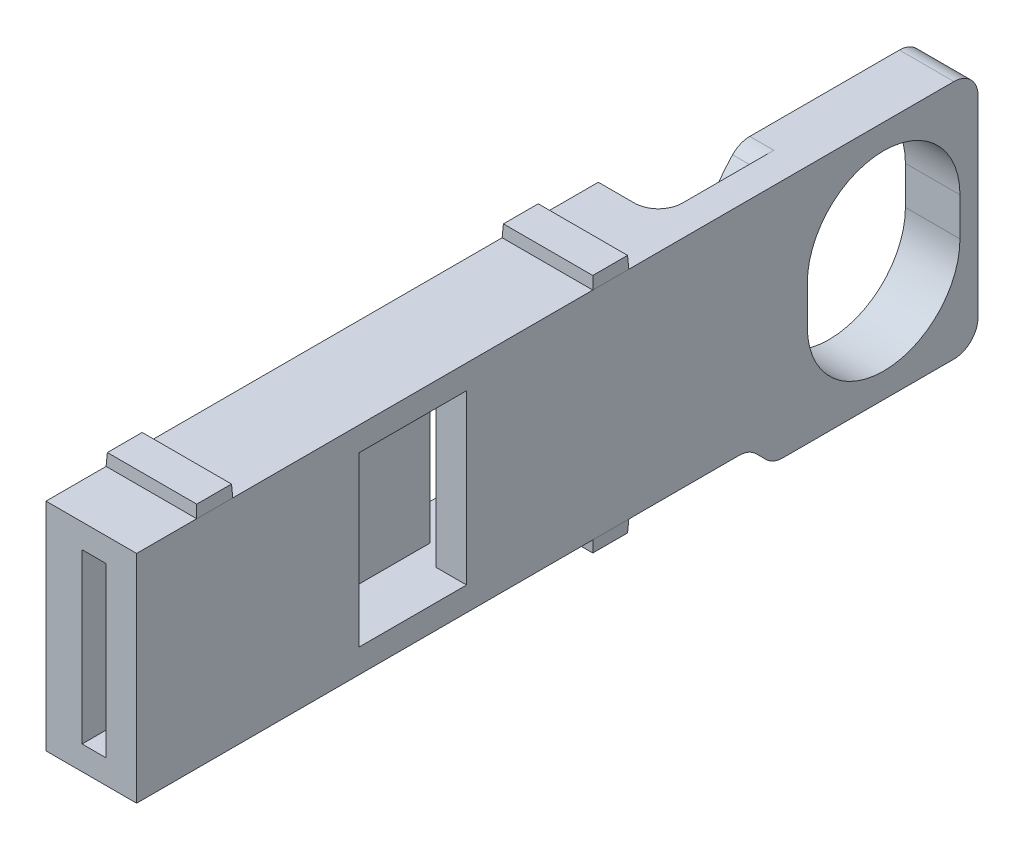
from build123d import *

# Parameters (mm, degrees)
EXTRUDE1_DEPTH           = 2.54
EXTRUDE2_START           = 2
EXTRUDE2_DEPTH           = 2
SKETCH4_W                = 45.95
SKETCH4_H                = 18
SKETCH4_W_2              = 41.95
SKETCH4_H_2              = 14
EXTRUDE3_DEPTH           = 5
SKETCH5_W                = 11.95
SKETCH5_H                = 14
EXTRUDE4_DEPTH           = 5
SKETCH6_W                = 2
SKETCH6_H                = 14
CUT_EXTRUDE1_DEPTH       = 43.95
CUT_EXTRUDE2_REACH       = 65.399
SKETCH7_W                = 8.95
SKETCH7_H                = 14
FILLET1_R                = 2
SKETCH8_W                = 7.54
SKETCH8_H                = 3
EXTRUDE5_DEPTH           = 1
EXTRUDE5_DRAFT           = 3
EXTRUDE5_PROFILE_2_DEPTH = 1
EXTRUDE5_PROFILE_2_DRAFT = 3
SKETCH9_W                = 7.54
SKETCH9_H                = 3
EXTRUDE6_DEPTH           = 1
EXTRUDE6_TAPER           = 3


with BuildPart() as part:
    # Sketch1 → Extrude1 (new body)
    with BuildSketch(Plane(origin=(0, 0, 0), x_dir=(0, 0, -1), z_dir=(1, 0, 0))):
        Polygon((-62.15, 10), (7.85, 10), (7.85, -10), (-9.2, -10), (-11.2, -8), (-62.15, -8), align=None)
        with BuildLine():
            Line((-6.35, 1.5875), (-6.35, -1.5875))
            ThreePointArc((-6.35, -1.5875), (0, -7.9375), (6.35, -1.5875))
            Line((6.35, -1.5875), (6.35, 1.5875))
            ThreePointArc((6.35, 1.5875), (0, 7.9375), (-6.35, 1.5875))
        make_face(mode=Mode.SUBTRACT)
    extrude(amount=EXTRUDE1_DEPTH)

    # Sketch3 → Extrude2 (add)
    with BuildSketch(Plane.ZY.offset(EXTRUDE2_START)):
        with BuildLine():
            Line((11.2, -8), (11.200000082, 1.5875))
            ThreePointArc((11.200000082, 1.5875), (10.204208676, 6.204222555), (7.393905977, 10))
            Line((7.393905977, 10), (-7.85, 10))
            Line((-7.85, 10), (-7.85, -10))
            Line((-7.85, -10), (9.2, -10))
            Line((9.2, -10), (11.2, -8))
        make_face()
        with BuildLine():
            Line((6.35, 1.5875), (6.35, -1.5875))
            ThreePointArc((6.35, -1.5875), (0, -7.9375), (-6.35, -1.5875))
            Line((-6.35, -1.5875), (-6.35, 1.5875))
            ThreePointArc((-6.35, 1.5875), (0, 7.9375), (6.35, 1.5875))
        make_face(mode=Mode.SUBTRACT)
    extrude(amount=-EXTRUDE2_DEPTH)

    # Sketch4 → Extrude3 (add)
    with BuildSketch(Plane.ZY):
        with Locations((39.175, 1)):
            Rectangle(SKETCH4_W, SKETCH4_H)
        with Locations((39.175, 1)):
            Rectangle(SKETCH4_W_2, SKETCH4_H_2, mode=Mode.SUBTRACT)
    extrude(amount=EXTRUDE3_DEPTH)

    # Sketch5 → Extrude4 (add)
    with BuildSketch(Plane.ZY):
        with Locations((39.175, 1)):
            Rectangle(SKETCH5_W, SKETCH5_H)
    extrude(amount=EXTRUDE4_DEPTH)

    # Sketch6 → Cut-Extrude1 (cut)
    with BuildSketch(Plane.XY.offset(62.15)):
        with Locations((-1, 1)):
            Rectangle(SKETCH6_W, SKETCH6_H)
    extrude(amount=-CUT_EXTRUDE1_DEPTH, mode=Mode.SUBTRACT)

    # Sketch7 → Cut-Extrude2 (cut, up to next)
    with BuildSketch(Plane(origin=(2.54, 0, 0), x_dir=(0, 0, -1), z_dir=(1, 0, 0)), mode=Mode.PRIVATE) as cut_extrude2_sk1:
        with Locations((-39.175, 1)):
            Rectangle(SKETCH7_W, SKETCH7_H)
    cut_extrude2_tool1 = extrude(cut_extrude2_sk1.sketch, amount=-CUT_EXTRUDE2_REACH, mode=Mode.PRIVATE) & part.part
    add(cut_extrude2_tool1.solids().sort_by_distance((2.54, 1, 39.175))[0], mode=Mode.SUBTRACT)

    # Fillet1
    fillet1_edges = [part.edges().sort_by_distance(p)[0] for p in [
        (0.27, 10, -7.85),
        (0.27, -10, -7.85),
        (0.27, -10, 9.2),
        (1.27, -8, 11.2),
        (-1, 10, 7.393905977),
        (0, 1, 16.2),
    ]]
    fillet(fillet1_edges, radius=FILLET1_R)


with BuildPart() as extrude5_tool:
    # Sketch8 → Extrude5 (with draft: the straight prism first)
    with BuildSketch(Plane(origin=(0, 10, 0), x_dir=(1, 0, 0), z_dir=(0, 1, 0))):
        with Locations((-1.23, -22.7)):
            Rectangle(SKETCH8_W, SKETCH8_H)
    extrude(amount=EXTRUDE5_DEPTH)
    # Extrude5: the draft: its side faces are tilted about the plane it starts from
    extrude5_sides = [extrude5_tool.faces().sort_by_distance(p)[0] for p in [
        (-5, 10.5, 22.7),
        (-1.23, 10.5, 24.2),
        (2.54, 10.5, 22.7),
        (-1.23, 10.5, 21.2),
    ]]
    draft(extrude5_sides, Plane(origin=(0, 10, 0), x_dir=(1, 0, 0), z_dir=(0, 1, 0)), EXTRUDE5_DRAFT)


with BuildPart() as part_1:
    add(part.part)

    # Extrude5: add extrude5_tool
    add(extrude5_tool.part)


with BuildPart() as extrude5_profile_2_tool:
    # Sketch8 → Extrude5 profile 2 (with draft: the straight prism first)
    with BuildSketch(Plane(origin=(0, 10, 0), x_dir=(1, 0, 0), z_dir=(0, 1, 0))):
        with Locations((-1.23, -55.65)):
            Rectangle(SKETCH8_W, SKETCH8_H)
    extrude(amount=EXTRUDE5_PROFILE_2_DEPTH)
    # Extrude5 profile 2: the draft: its side faces are tilted about the plane it starts from
    extrude5_profile_2_sides = [extrude5_profile_2_tool.faces().sort_by_distance(p)[0] for p in [
        (-5, 10.5, 55.65),
        (-1.23, 10.5, 57.15),
        (2.54, 10.5, 55.65),
        (-1.23, 10.5, 54.15),
    ]]
    draft(extrude5_profile_2_sides, Plane(origin=(0, 10, 0), x_dir=(1, 0, 0), z_dir=(0, 1, 0)), EXTRUDE5_PROFILE_2_DRAFT)


with BuildPart() as part_2:
    add(part_1.part)

    # Extrude5 profile 2: add extrude5_profile_2_tool
    add(extrude5_profile_2_tool.part)

    # Sketch9 → Extrude6 (add)
    with BuildSketch(Plane.XZ.offset(8)):
        with Locations((-1.23, 22.7)):
            Rectangle(SKETCH9_W, SKETCH9_H)
    extrude(amount=EXTRUDE6_DEPTH, taper=EXTRUDE6_TAPER)


solid = part_2.part
